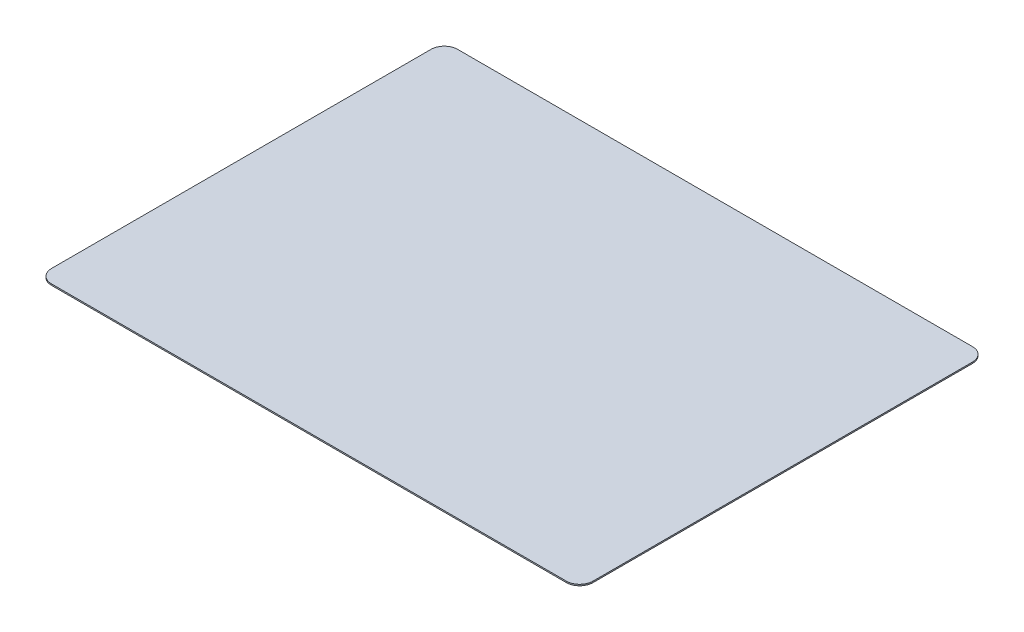
from build123d import *

# Parameters (mm, degrees)
SKETCH1_W           = 406.4
SKETCH1_H           = 304.8
BOSS_EXTRUDE1_DEPTH = 1
FILLET1_R           = 10


with BuildPart() as part:
    # Sketch1 → Boss-Extrude1 (new body)
    with BuildSketch(Plane(origin=(0, 0, 0), x_dir=(1, 0, 0), z_dir=(0, 1, 0))):
        Rectangle(SKETCH1_W, SKETCH1_H)
    extrude(amount=BOSS_EXTRUDE1_DEPTH)

    # Fillet1
    fillet1_edges = [part.edges().sort_by_distance(p)[0] for p in [
        (203.2, 0.5, 152.4),
        (-203.2, 0.5, 152.4),
        (-203.2, 0.5, -152.4),
        (203.2, 0.5, -152.4),
    ]]
    fillet(fillet1_edges, radius=FILLET1_R)


solid = part.part
